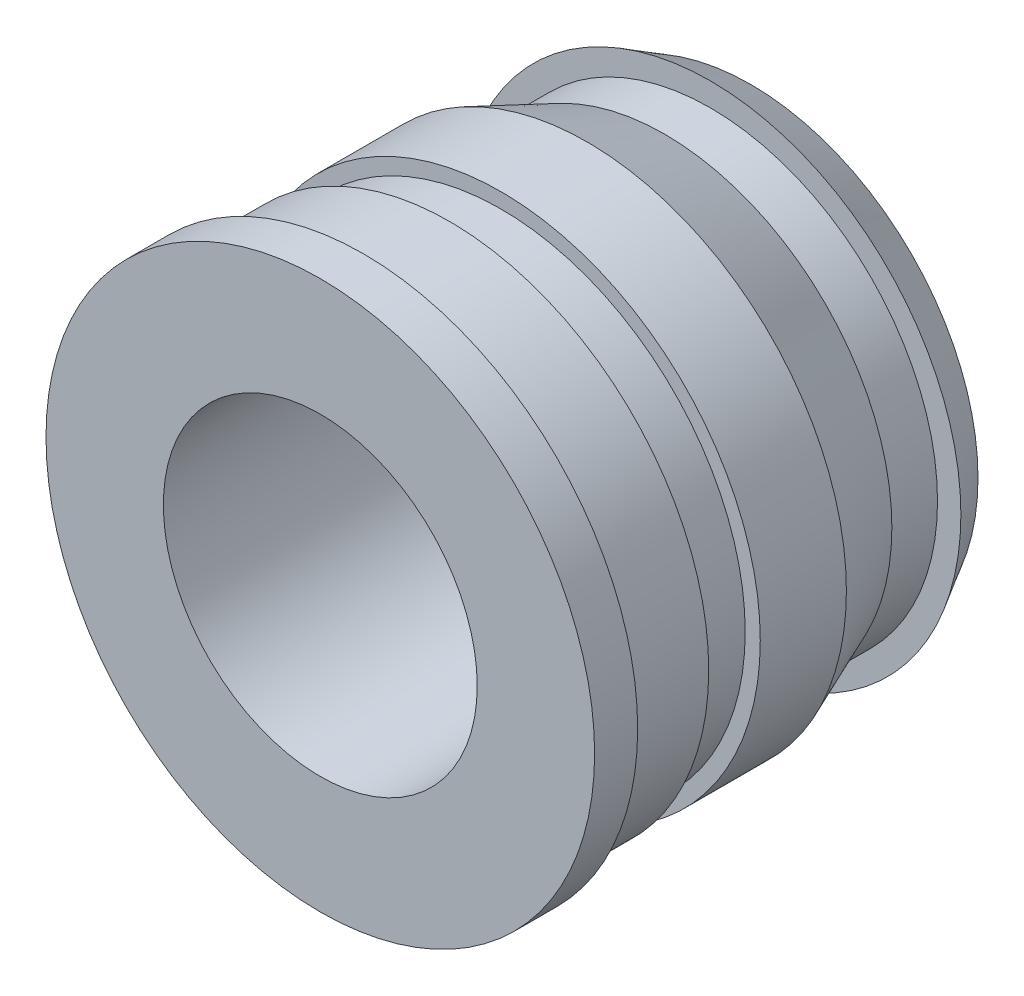
from build123d import *


with BuildPart() as part:
    # Sketch3 → Revolve1 (revolve)
    with BuildSketch(Plane(origin=(0, 0, 0), x_dir=(0, 0, -1), z_dir=(1, 0, 0))):
        Polygon((-1.715, 1.25), (-1.715, 2.185), (-1.372, 2.185), (-1.372, 2.065), (-0.686, 2.065), (-0.686, 1.945), (-0.275400804, 1.945), (-0.275400804, 2.065), (0.410599196, 2.065), (1.029, 1.80885), (1.392578742, 1.80885), (1.392578742, 1.995), (1.715, 1.80885), (1.715, 1.25), align=None)
    revolve(axis=Axis((0, 0, 1.715), (0, 0, -1)))


solid = part.part
